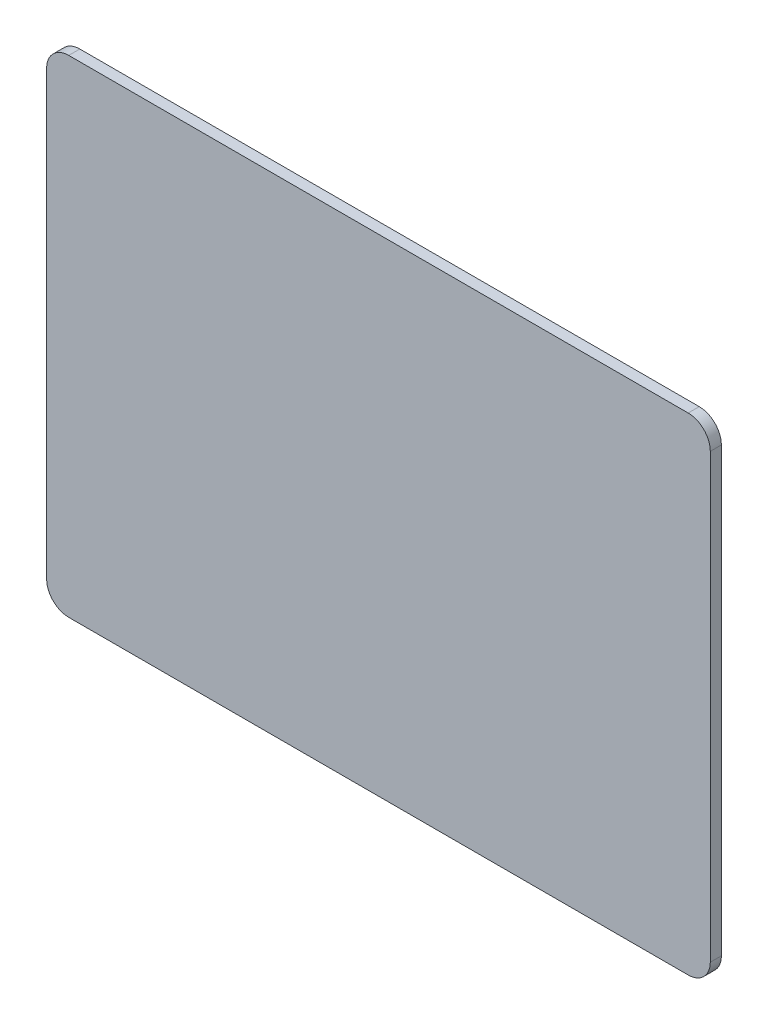
from build123d import *

# Parameters (mm, degrees)
BOSS_EXTRUDE1_DEPTH = 5


with BuildPart() as part:
    # Sketch1 → Boss-Extrude1 (new body)
    with BuildSketch(Plane.XY):
        with BuildLine():
            Line((-290, 110), (-10, 110))
            ThreePointArc((-10, 110), (-2.928932188, 107.071067812), (0, 100))
            Line((0, 100), (0, -100))
            ThreePointArc((0, -100), (-2.928932188, -107.071067812), (-10, -110))
            Line((-10, -110), (-290, -110))
            ThreePointArc((-290, -110), (-297.071067812, -107.071067812), (-300, -100))
            Line((-300, -100), (-300, 100))
            ThreePointArc((-300, 100), (-297.071067812, 107.071067812), (-290, 110))
        make_face()
    extrude(amount=BOSS_EXTRUDE1_DEPTH)


solid = part.part
